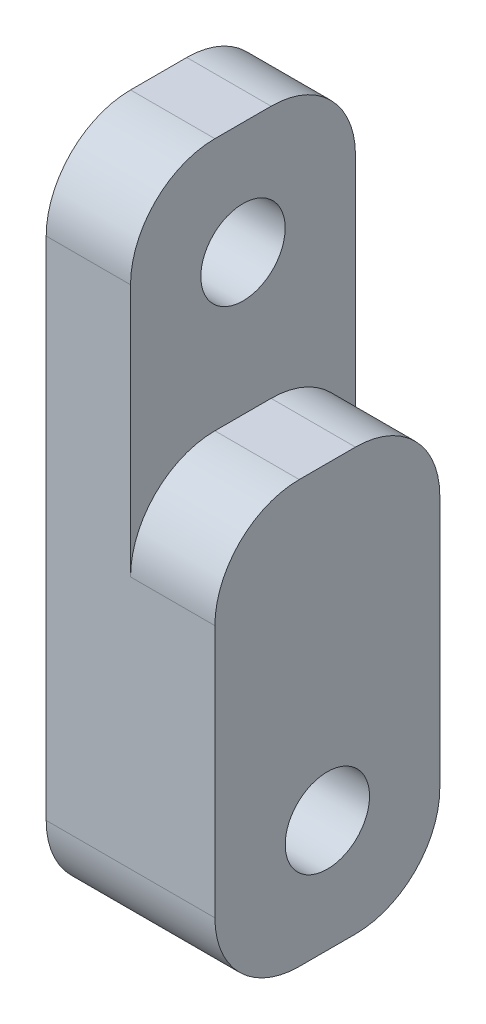
from build123d import *

# Parameters (mm, degrees)
SKETCH1_W           = 40
SKETCH1_H           = 120
SKETCH1_R           = 7.5
BOSS_EXTRUDE1_DEPTH = 30
FILLET1_R           = 15
SKETCH2_R           = 7.5
CUT_EXTRUDE1_DEPTH  = 15
FILLET2_R           = 15


with BuildPart() as part:
    # Sketch1 → Boss-Extrude1 (new body)
    with BuildSketch(Plane(origin=(0, 0, 0), x_dir=(0, 0, -1), z_dir=(1, 0, 0))):
        Rectangle(SKETCH1_W, SKETCH1_H)
        with Locations((0, 40)):
            Circle(SKETCH1_R, mode=Mode.SUBTRACT)
        with Locations((0, -40)):
            Circle(SKETCH1_R, mode=Mode.SUBTRACT)
    extrude(amount=BOSS_EXTRUDE1_DEPTH)

    # Fillet1
    fillet1_edges = [part.edges().sort_by_distance(p)[0] for p in [
        (15, 60, 20),
        (15, 60, -20),
        (15, -60, -20),
        (15, -60, 20),
    ]]
    fillet(fillet1_edges, radius=FILLET1_R)

    # Sketch2 → Cut-Extrude1 (cut)
    with BuildSketch(Plane(origin=(30, 0, 0), x_dir=(0, 0, -1), z_dir=(1, 0, 0))):
        with BuildLine():
            Line((-20, 45), (-20, 15))
            Line((-20, 15), (20, 15))
            Line((20, 15), (20, 45))
            ThreePointArc((20, 45), (15.606601718, 55.606601718), (5, 60))
            Line((5, 60), (-5, 60))
            ThreePointArc((-5, 60), (-15.606601718, 55.606601718), (-20, 45))
        make_face()
        with Locations((0, 40)):
            Circle(SKETCH2_R, mode=Mode.SUBTRACT)
    extrude(amount=-CUT_EXTRUDE1_DEPTH, mode=Mode.SUBTRACT)

    # Fillet2
    fillet2_edges = [part.edges().sort_by_distance(p)[0] for p in [
        (22.5, 15, 20),
        (22.5, 15, -20),
    ]]
    fillet(fillet2_edges, radius=FILLET2_R)


solid = part.part
